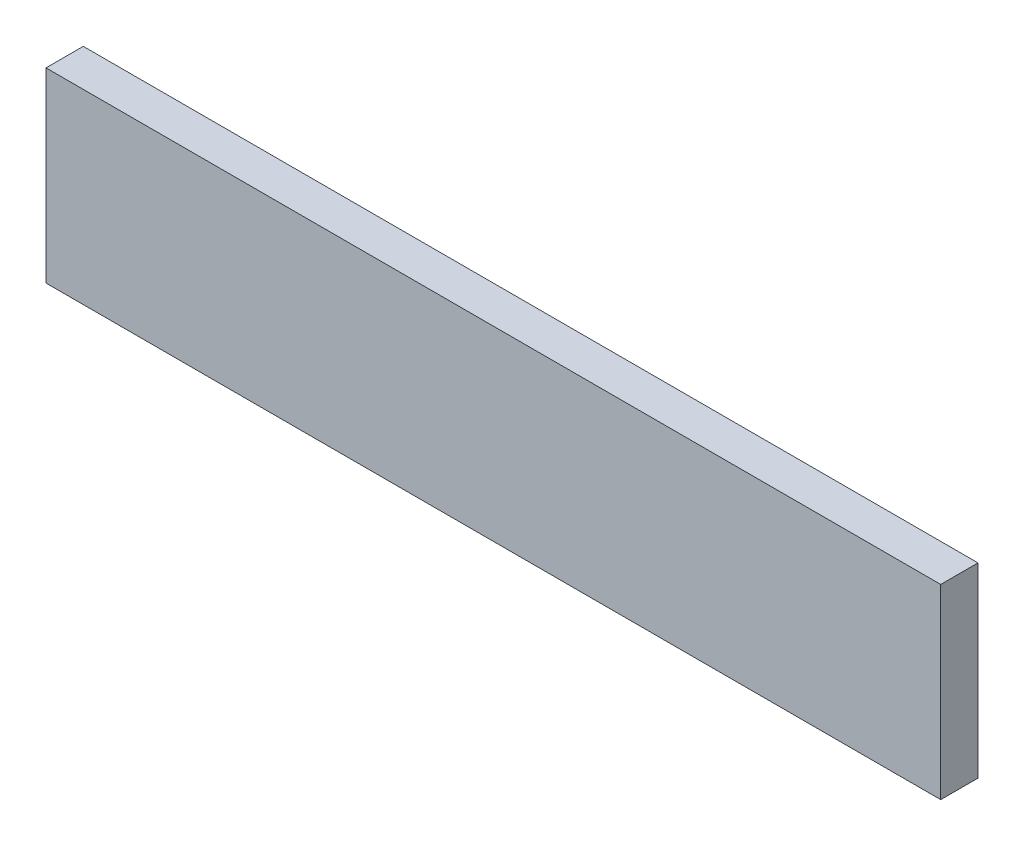
from build123d import *

# Parameters (mm, degrees)
SKETCH1_W           = 152.4
SKETCH1_H           = 31.75
BOSS_EXTRUDE1_DEPTH = 6.35


with BuildPart() as part:
    # Sketch1 → Boss-Extrude1 (new body)
    with BuildSketch(Plane.XY):
        Rectangle(SKETCH1_W, SKETCH1_H)
    extrude(amount=-BOSS_EXTRUDE1_DEPTH)


solid = part.part
